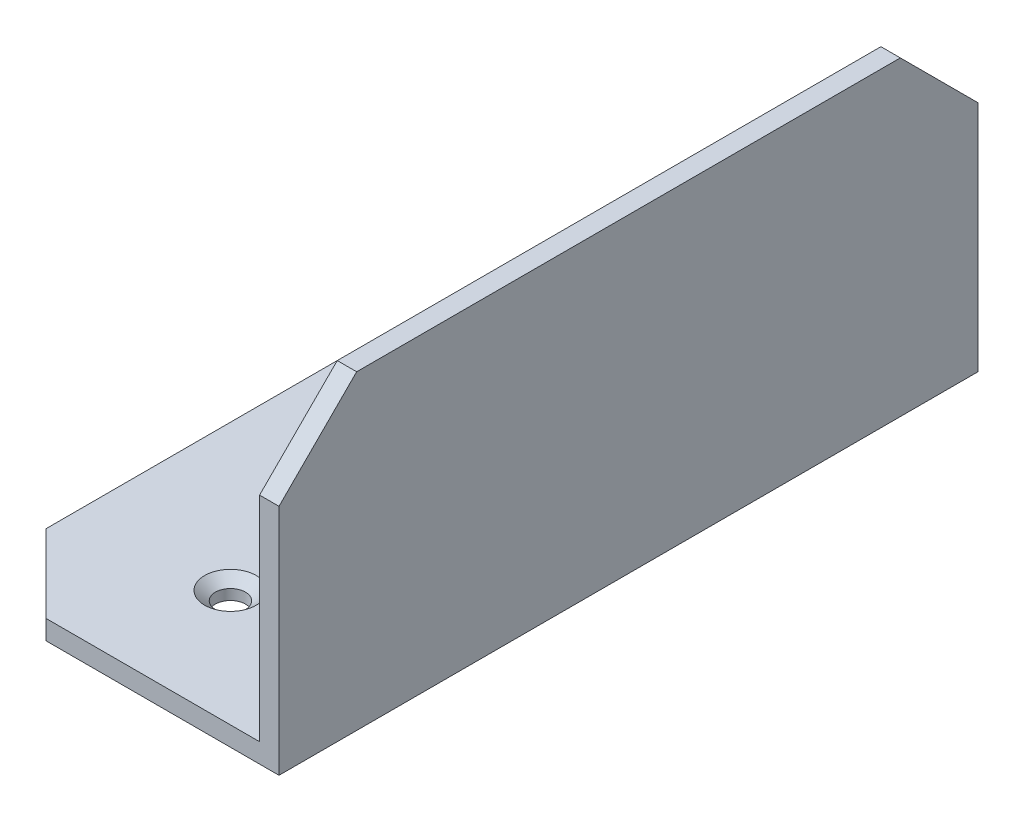
from build123d import *

# Parameters (mm, degrees)
BOSS_EXTRUDE1_DEPTH                       = 114.3
CHAMFER1_SIZE                             = 12.7
CSK_FOR_8_FLAT_HEAD_MACHINE_SCREW_2_COUNT = 2
CSK_FOR_8_FLAT_HEAD_MACHINE_SCREW_2_PITCH = 76.2
CSK_FOR_8_FLAT_HEAD_MACHINE_SCREW_3_COUNT = 2
CSK_FOR_8_FLAT_HEAD_MACHINE_SCREW_3_PITCH = 38.1
CSK_FOR_8_FLAT_HEAD_MACHINE_SCREW_4_COUNT = 2
CSK_FOR_8_FLAT_HEAD_MACHINE_SCREW_4_PITCH = 44.45


with BuildPart() as part:
    # Sketch2 → Boss-Extrude1 (new body)
    with BuildSketch(Plane.XY):
        Polygon((0, 0), (0, 50.8), (-3.175, 50.8), (-3.175, 3.175), (-50.8, 3.175), (-50.8, 0), align=None)
    extrude(amount=-BOSS_EXTRUDE1_DEPTH)

    # Chamfer1
    chamfer1_edges = [part.edges().sort_by_distance(p)[0] for p in [
        (-1.5875, 50.8, -114.3),
        (-50.8, 1.5875, -114.3),
        (-50.8, 1.5875, 0),
        (-1.5875, 50.8, 0),
    ]]
    chamfer(chamfer1_edges, length=CHAMFER1_SIZE)

    # Sketch4 → CSK for #8 Flat Head Machine Screw (100)1 (revolve, cut)
    with BuildSketch(Plane(origin=(-26.9875, 3.175, -95.25), x_dir=(0, 0, 1), z_dir=(1, 0, 0))):
        Polygon((0, 0), (0, 3.175), (2.45745, 3.175), (2.45745, 1.475934296), (4.2164, 0), align=None)
    csk_for_8_flat_head_machine_screw_100 = revolve(axis=Axis((-26.9875, 9.525, -95.25), (0, -1, 0)), mode=Mode.SUBTRACT)

    # CSK for _8 Flat Head Machine Screw _ 2: CSK for #8 Flat Head Machine Screw (100)1 ×2
    with Locations(*[(0, 0, i * CSK_FOR_8_FLAT_HEAD_MACHINE_SCREW_2_PITCH) for i in range(1, CSK_FOR_8_FLAT_HEAD_MACHINE_SCREW_2_COUNT)]):
        add(csk_for_8_flat_head_machine_screw_100, mode=Mode.SUBTRACT)

    # CSK for _8 Flat Head Machine Screw _ 3: CSK for #8 Flat Head Machine Screw (100)1 ×2
    with Locations(*[(0, 0, i * CSK_FOR_8_FLAT_HEAD_MACHINE_SCREW_3_PITCH) for i in range(1, CSK_FOR_8_FLAT_HEAD_MACHINE_SCREW_3_COUNT)]):
        add(csk_for_8_flat_head_machine_screw_100, mode=Mode.SUBTRACT)

    # CSK for _8 Flat Head Machine Screw _ 4: CSK for #8 Flat Head Machine Screw (100)1 ×2
    with Locations(*[(0, 0, -i * CSK_FOR_8_FLAT_HEAD_MACHINE_SCREW_4_PITCH) for i in range(1, CSK_FOR_8_FLAT_HEAD_MACHINE_SCREW_4_COUNT)]):
        add(csk_for_8_flat_head_machine_screw_100, mode=Mode.SUBTRACT)


solid = part.part
